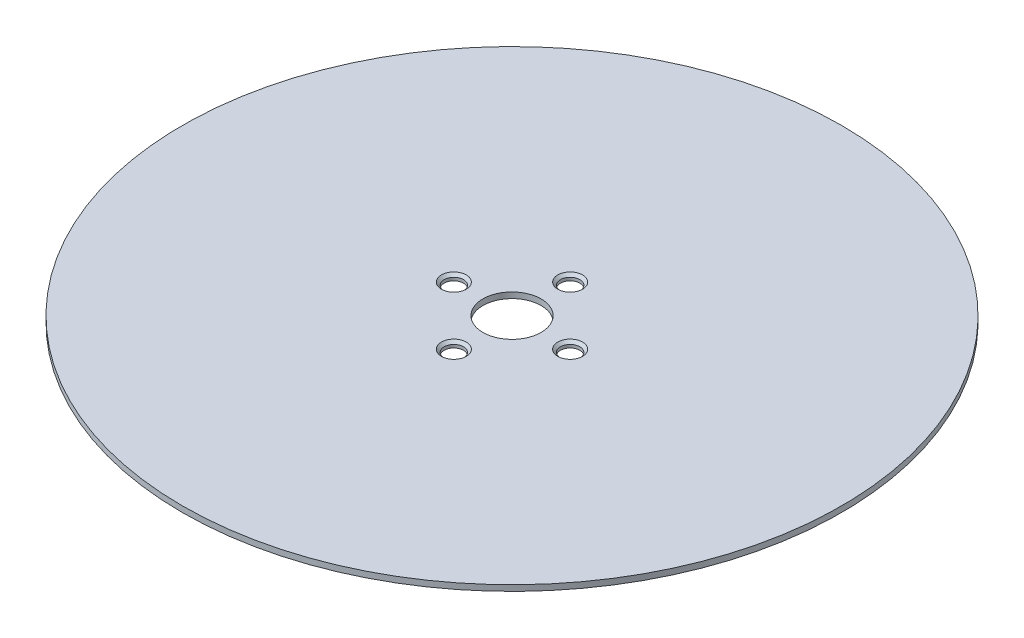
from build123d import *

# Parameters (mm, degrees)
SKETCH_1_R       = 170
SKETCH_1_R_2     = 15
SKETCH_1_R_3     = 5
EXTRUDE_1_DEPTH  = 1.5
MM_2_D           = 1
MM_2_DEPTH       = 12.4
MM_2_CSINK_D     = 12.8
MM_2_CSINK_ANGLE = 90
MM_2_TIP         = 0.30043031


with BuildPart() as part:
    # 草图1 → 凸台-拉伸1 (new, symmetric)
    with BuildSketch(Plane(origin=(0, 0, 0), x_dir=(1, 0, 0), z_dir=(0, 1, 0))):
        with Locations(Location((0, 0, 0), (0, 0, 270))):
            Circle(SKETCH_1_R)
        with Locations(Location((0, 0, 0), (0, 0, 270))):
            Circle(SKETCH_1_R_2, mode=Mode.SUBTRACT)
        with Locations(Location((-30, 0, 0), (0, 0, 270))):
            Circle(SKETCH_1_R_3, mode=Mode.SUBTRACT)
        with Locations(Location((0, 30, 0), (0, 0, 270))):
            Circle(SKETCH_1_R_3, mode=Mode.SUBTRACT)
        with Locations(Location((30, 0, 0), (0, 0, 270))):
            Circle(SKETCH_1_R_3, mode=Mode.SUBTRACT)
        with Locations(Location((0, -30, 0), (0, 0, 270))):
            Circle(SKETCH_1_R_3, mode=Mode.SUBTRACT)
    extrude(amount=EXTRUDE_1_DEPTH, both=True)

    # 大小mm 暗销孔2
    with Locations(Plane(origin=(0, 1.5, 0), x_dir=(1, 0, 0), z_dir=(0, 1, 0))):
        with Locations((-30, 0), (0, 30), (30, 0), (0, -30)):
            CounterSinkHole(MM_2_D / 2, MM_2_CSINK_D / 2, depth=MM_2_DEPTH, counter_sink_angle=MM_2_CSINK_ANGLE)
            with Locations((0, 0, -(MM_2_DEPTH + MM_2_TIP / 2))):  # 118° drill point
                Cone(0, MM_2_D / 2, MM_2_TIP, mode=Mode.SUBTRACT)


solid = part.part
